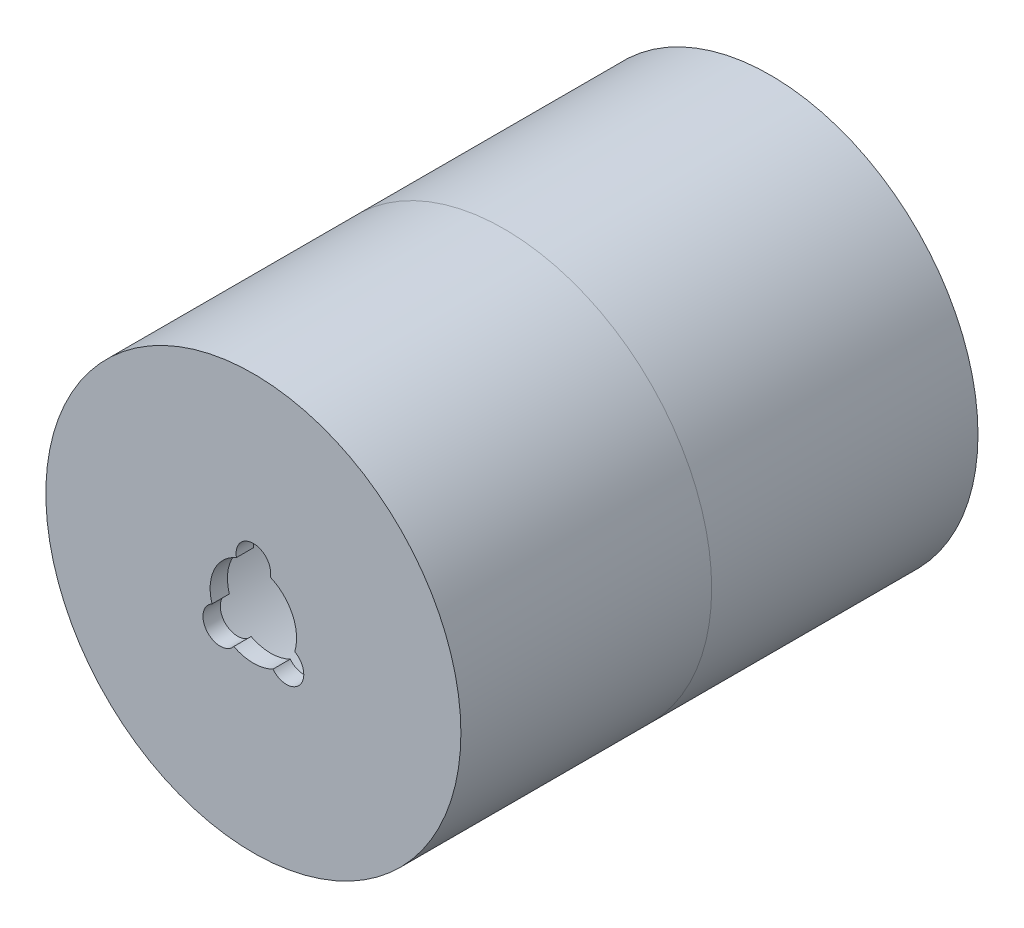
from build123d import *

# Parameters (mm, degrees)
CUT_EXTRUDE1_DEPTH = 2
CUT_EXTRUDE2_DEPTH = 1
CUT_EXTRUDE3_REACH = 70.761


with BuildPart() as part:
    # Sketch1 → Revolve1 (revolve)
    with BuildSketch(Plane(origin=(0, 0, 0), x_dir=(0, 0, -1), z_dir=(1, 0, 0))):
        Polygon((-59.8, 5), (-57.8, 5), (-57.8, 17), (-1.8, 17), (-1.8, 13), (0, 13), (0, 24), (-59.8, 24), align=None)
    revolve(axis=Axis((0, 0, 1072.381477522), (0, 0, -1)))

    # Sketch3 → Cut-Extrude1 (cut, symmetric)
    with BuildSketch(Plane.XY.offset(30.8)):
        with BuildLine():
            ThreePointArc((-6.566786752, 18.042098319), (0, -19.2), (6.566786752, 18.042098319))
            Line((6.566786752, 18.042098319), (7.592847182, 20.861176181))
            ThreePointArc((7.592847182, 20.861176181), (0, 22.2), (-7.592847182, 20.861176181))
            Line((-7.592847182, 20.861176181), (-6.566786752, 18.042098319))
        make_face()
        with BuildLine():
            add(Edge.make_bspline(
                [(-1, 19.972224976), (-1.837517439, 19.972224976), (-3.400688885, 17.606551444), (-4.505268868, 16.51808236)],
                knots=[0, 0, 0, 0, 1, 1, 1, 1], degree=3))
            Line((-1, 19.972224976), (1, 19.972224976))
            add(Edge.make_bspline(
                [(1, 19.972224976), (1.837517439, 19.972224976), (3.400688885, 17.606551444), (4.505268868, 16.51808236)],
                knots=[0, 0, 0, 0, 1, 1, 1, 1], degree=3))
            Line((4.505268868, 16.51808236), (4.683975969, 16.341981799))
            ThreePointArc((4.683975969, 16.341981799), (13.576221703, 10.231627645), (17, 0))
            ThreePointArc((17, 0), (-10.231627645, -13.576221703), (-4.683975969, 16.341981799))
            Line((-4.683975969, 16.341981799), (-4.505268868, 16.51808236))
        make_face(mode=Mode.SUBTRACT)
    extrude(amount=CUT_EXTRUDE1_DEPTH, both=True, mode=Mode.SUBTRACT)

    # Sketch3<5> → Cut-Extrude2 (cut, symmetric)
    with BuildSketch(Plane.XY.offset(30.8)):
        with BuildLine():
            Line((1, 19.972224976), (-1, 19.972224976))
            add(Edge.make_bspline(
                [(-1, 19.972224976), (-1.837517439, 19.972224976), (-3.400688885, 17.606551444), (-4.505268868, 16.51808236)],
                knots=[0, 0, 0, 0, 1, 1, 1, 1], degree=3))
            Line((-4.505268868, 16.51808236), (-4.683975969, 16.341981799))
            ThreePointArc((-4.683975969, 16.341981799), (0, -17), (4.683975969, 16.341981799))
            Line((4.683975969, 16.341981799), (4.505268868, 16.51808236))
            add(Edge.make_bspline(
                [(1, 19.972224976), (1.837517439, 19.972224976), (3.400688885, 17.606551444), (4.505268868, 16.51808236)],
                knots=[0, 0, 0, 0, 1, 1, 1, 1], degree=3))
        make_face()
        with BuildLine():
            Line((7.592847182, 20.861176181), (6.566786752, 18.042098319))
            ThreePointArc((6.566786752, 18.042098319), (0, -19.2), (-6.566786752, 18.042098319))
            Line((-6.566786752, 18.042098319), (-7.592847182, 20.861176181))
            ThreePointArc((-7.592847182, 20.861176181), (0, -22.2), (7.592847182, 20.861176181))
        make_face()
    extrude(amount=CUT_EXTRUDE2_DEPTH, both=True, mode=Mode.SUBTRACT)

    # Sketch5 → Cut-Extrude3 (cut, up to next)
    with BuildSketch(Plane.XY.offset(59.8), mode=Mode.PRIVATE) as cut_extrude3_sk1:
        with BuildLine():
            ThreePointArc((1.959591794, 4.6), (0, 7), (-1.959591794, 4.6))
            ThreePointArc((-1.959591794, 4.6), (0, 5), (1.959591794, 4.6))
        make_face()
    cut_extrude3_tool1 = extrude(cut_extrude3_sk1.sketch, amount=-CUT_EXTRUDE3_REACH, mode=Mode.PRIVATE) & part.part
    # Sketch5 → Cut-Extrude3 (cut, up to next)
    with BuildSketch(Plane.XY.offset(59.8), mode=Mode.PRIVATE) as cut_extrude3_sk2:
        with BuildLine():
            ThreePointArc((-2.264203113, -4.457957409), (-3.830222216, -3.213938048), (-4.783405764, -1.4556886))
            ThreePointArc((-4.783405764, -1.4556886), (-5.362311102, -4.499513268), (-2.264203113, -4.457957409))
        make_face()
    cut_extrude3_tool2 = extrude(cut_extrude3_sk2.sketch, amount=-CUT_EXTRUDE3_REACH, mode=Mode.PRIVATE) & part.part
    # Sketch5 → Cut-Extrude3 (cut, up to next)
    with BuildSketch(Plane.XY.offset(59.8), mode=Mode.PRIVATE) as cut_extrude3_sk3:
        with BuildLine():
            ThreePointArc((2.264203113, -4.457957409), (5.362311102, -4.499513268), (4.783405764, -1.4556886))
            ThreePointArc((4.783405764, -1.4556886), (3.830222216, -3.213938048), (2.264203113, -4.457957409))
        make_face()
    cut_extrude3_tool3 = extrude(cut_extrude3_sk3.sketch, amount=-CUT_EXTRUDE3_REACH, mode=Mode.PRIVATE) & part.part
    add(cut_extrude3_tool1.solids().sort_by_distance((0, 5.772711, 59.8))[0], mode=Mode.SUBTRACT)
    add(cut_extrude3_tool2.solids().sort_by_distance((-4.422153, -3.710627, 59.8))[0], mode=Mode.SUBTRACT)
    add(cut_extrude3_tool3.solids().sort_by_distance((4.422153, -3.710627, 59.8))[0], mode=Mode.SUBTRACT)


with BuildPart() as body_2:
    # Split4: the piece on the far side of the plane
    add(part.part)
    split(bisect_by=Plane.XY.offset(30.8), keep=Keep.BOTTOM)


with BuildPart() as part_1:
    add(part.part)

    # Split4
    split(bisect_by=Plane.XY.offset(30.8), keep=Keep.TOP)


solid = Compound([body_2.part, part_1.part])
